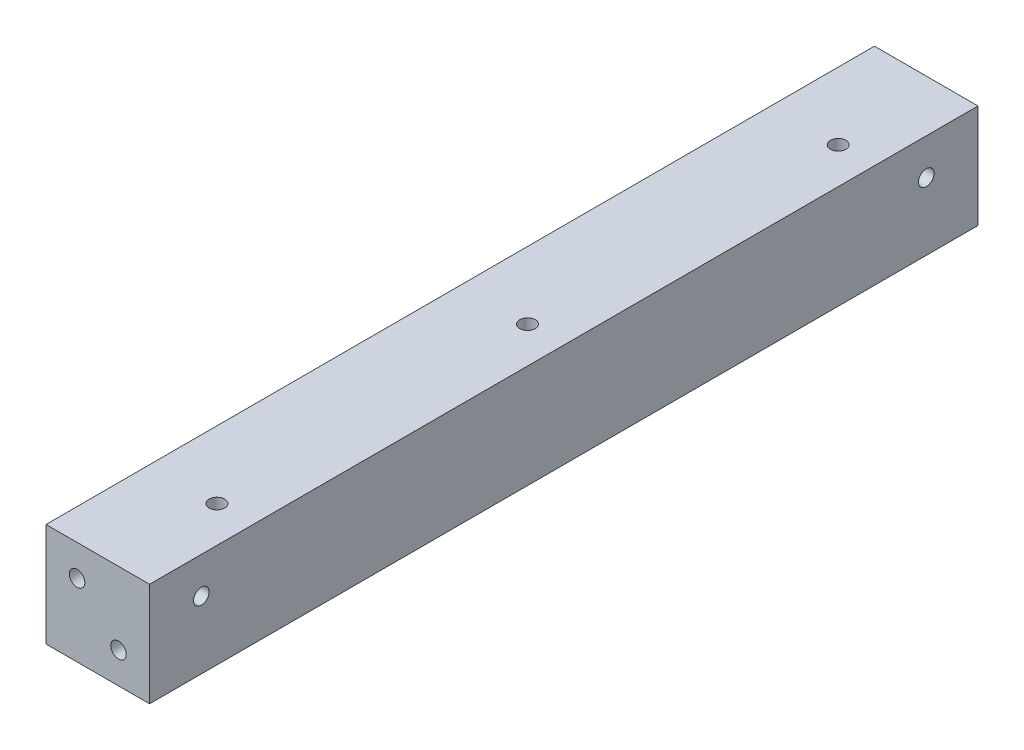
from build123d import *

# Parameters (mm, degrees)
IZIM1_W                     = 20
IZIM1_H                     = 20
Y_KSEKLIK_EKSTR_ZYON1_DEPTH = 160
IZIM13_R                    = 1.5
KES_EKSTR_ZYON1_DEPTH       = 10
KES_EKSTR_ZYON2_START       = -10
IZIM15_R                    = 1.5
KES_EKSTR_ZYON2_DEPTH       = 10
IZIM18_R                    = 1.5
KES_EKSTR_ZYON3_DEPTH       = 10
IZIM20_R                    = 1.5
KES_EKSTR_ZYON4_DEPTH       = 10
SKETCH1_R                   = 1.5
CUT_EXTRUDE1_DEPTH          = 10
SKETCH2_R                   = 1.5
CUT_EXTRUDE2_DEPTH          = 10


with BuildPart() as part:
    # Çizim1 → Yükseklik-Ekstrüzyon1 (new body)
    with BuildSketch(Plane.XY):
        with Locations((10, 10)):
            Rectangle(IZIM1_W, IZIM1_H)
    extrude(amount=Y_KSEKLIK_EKSTR_ZYON1_DEPTH)

    # Çizim13 → Kes-Ekstrüzyon1 (cut)
    with BuildSketch(Plane.XY.offset(160)):
        with Locations((14, 6)):
            Circle(IZIM13_R)
        with Locations((6, 14)):
            Circle(IZIM13_R)
    extrude(amount=-KES_EKSTR_ZYON1_DEPTH, mode=Mode.SUBTRACT)

    # Çizim15 → Kes-Ekstrüzyon2 (cut)
    with BuildSketch(Plane(origin=(0, 0, 0), x_dir=(-1, 0, 0), z_dir=(0, 0, -1)).offset(KES_EKSTR_ZYON2_START)):
        with Locations(Location((-14, 6, 0), (0, 0, 180))):
            Circle(IZIM15_R)
        with Locations(Location((-6, 14, 0), (0, 0, 180))):
            Circle(IZIM15_R)
    extrude(amount=KES_EKSTR_ZYON2_DEPTH, mode=Mode.SUBTRACT)

    # Çizim18 → Kes-Ekstrüzyon3 (cut)
    with BuildSketch(Plane(origin=(20, 0, 0), x_dir=(0, 0, -1), z_dir=(1, 0, 0))):
        with Locations((-10, 13)):
            Circle(IZIM18_R)
        with Locations((-150, 13)):
            Circle(IZIM18_R)
    extrude(amount=-KES_EKSTR_ZYON3_DEPTH, mode=Mode.SUBTRACT)

    # Çizim20 → Kes-Ekstrüzyon4 (cut)
    with BuildSketch(Plane.XZ):
        with Locations(Location((7, 10, 0), (0, 0, 270))):
            Circle(IZIM20_R)
        with Locations(Location((7, 150, 0), (0, 0, 270))):
            Circle(IZIM20_R)
    extrude(amount=-KES_EKSTR_ZYON4_DEPTH, mode=Mode.SUBTRACT)

    # Sketch1 → Cut-Extrude1 (cut)
    with BuildSketch(Plane(origin=(0, 20, 0), x_dir=(1, 0, 0), z_dir=(0, 1, 0))):
        with Locations(Location((13, -20, 0), (0, 0, 270))):
            Circle(SKETCH1_R)
        with Locations(Location((13, -80, 0), (0, 0, 270))):
            Circle(SKETCH1_R)
        with Locations(Location((13, -140, 0), (0, 0, 270))):
            Circle(SKETCH1_R)
    extrude(amount=-CUT_EXTRUDE1_DEPTH, mode=Mode.SUBTRACT)

    # Sketch2 → Cut-Extrude2 (cut)
    with BuildSketch(Plane.ZY):
        with Locations((20, 7)):
            Circle(SKETCH2_R)
        with Locations((80, 7)):
            Circle(SKETCH2_R)
        with Locations((140, 7)):
            Circle(SKETCH2_R)
    extrude(amount=-CUT_EXTRUDE2_DEPTH, mode=Mode.SUBTRACT)


solid = part.part
